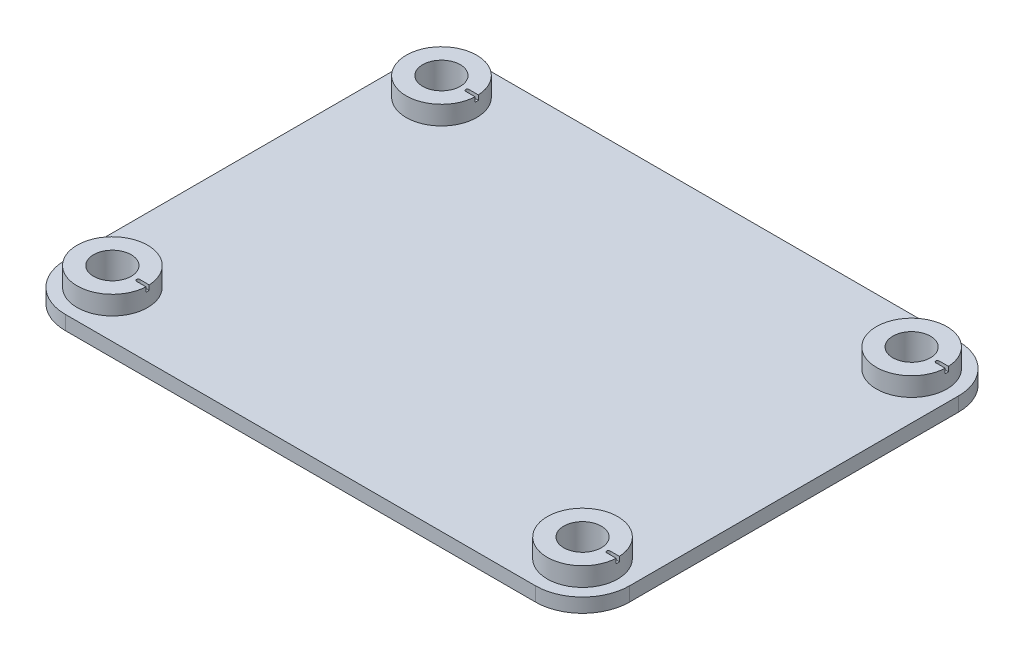
from build123d import *

# Parameters (mm, degrees)
SKETCH_1_R          = 30
EXTRUDE_1_DEPTH     = 10
SKETCH_2_R          = 40
EXTRUDE_2_DEPTH     = 60
CUT_EXTRUDE_START   = -40
SKETCH_3_R          = 75
CUT_EXTRUDE_1_DEPTH = 40
CUT_EXTRUDE_2_DEPTH = 10


with BuildPart() as part:
    # 草图1 → 凸台-拉伸1 (new body)
    with BuildSketch(Plane(origin=(0, 0, 0), x_dir=(1, 0, 0), z_dir=(0, 1, 0))):
        with BuildLine():
            Line((-500, -450), (500, -450))
            ThreePointArc((500, -450), (570.710678119, -420.710678119), (600, -350))
            Line((600, -350), (600, 350))
            ThreePointArc((600, 350), (570.710678119, 420.710678119), (500, 450))
            Line((500, 450), (-500, 450))
            ThreePointArc((-500, 450), (-570.710678119, 420.710678119), (-600, 350))
            Line((-600, 350), (-600, -350))
            ThreePointArc((-600, -350), (-570.710678119, -420.710678119), (-500, -450))
        make_face()
        with Locations((-500, 350)):
            Circle(SKETCH_1_R, mode=Mode.SUBTRACT)
        with Locations((500, 350)):
            Circle(SKETCH_1_R, mode=Mode.SUBTRACT)
        with Locations((-500, -350)):
            Circle(SKETCH_1_R, mode=Mode.SUBTRACT)
        with Locations((500, -350)):
            Circle(SKETCH_1_R, mode=Mode.SUBTRACT)
    extrude(amount=EXTRUDE_1_DEPTH)

    # 草图2 → 凸台-拉伸2 (add)
    with BuildSketch(Plane(origin=(0, 10, 0), x_dir=(1, 0, 0), z_dir=(0, 1, 0))):
        with BuildLine():
            Line((600, -350), (600, 350))
            ThreePointArc((600, 350), (570.710678119, 420.710678119), (500, 450))
            Line((500, 450), (-500, 450))
            ThreePointArc((-500, 450), (-570.710678119, 420.710678119), (-600, 350))
            Line((-600, 350), (-600, -350))
            ThreePointArc((-600, -350), (-570.710678119, -420.710678119), (-500, -450))
            Line((-500, -450), (500, -450))
            ThreePointArc((500, -450), (570.710678119, -420.710678119), (600, -350))
        make_face()
        with Locations((-500, 350)):
            Circle(SKETCH_2_R, mode=Mode.SUBTRACT)
        with Locations((-500, -350)):
            Circle(SKETCH_2_R, mode=Mode.SUBTRACT)
        with Locations((500, -350)):
            Circle(SKETCH_2_R, mode=Mode.SUBTRACT)
        with Locations((500, 350)):
            Circle(SKETCH_2_R, mode=Mode.SUBTRACT)
    extrude(amount=EXTRUDE_2_DEPTH)

    # 草图3 → 切除-拉伸1 (cut)
    with BuildSketch(Plane(origin=(0, 70, 0), x_dir=(1, 0, 0), z_dir=(0, 1, 0)).offset(CUT_EXTRUDE_START)):
        with BuildLine():
            Line((600, -350), (600, 350))
            ThreePointArc((600, 350), (570.710678119, 420.710678119), (500, 450))
            Line((500, 450), (-500, 450))
            ThreePointArc((-500, 450), (-570.710678119, 420.710678119), (-600, 350))
            Line((-600, 350), (-600, -350))
            ThreePointArc((-600, -350), (-570.710678119, -420.710678119), (-500, -450))
            Line((-500, -450), (500, -450))
            ThreePointArc((500, -450), (570.710678119, -420.710678119), (600, -350))
        make_face()
        with Locations((-500, 350)):
            Circle(SKETCH_3_R, mode=Mode.SUBTRACT)
        with Locations((-500, -350)):
            Circle(SKETCH_3_R, mode=Mode.SUBTRACT)
        with Locations((500, 350)):
            Circle(SKETCH_3_R, mode=Mode.SUBTRACT)
        with Locations((500, -350)):
            Circle(SKETCH_3_R, mode=Mode.SUBTRACT)
    extrude(amount=CUT_EXTRUDE_1_DEPTH, mode=Mode.SUBTRACT)

    # 草图7 → 切除-拉伸2 (cut)
    with BuildSketch(Plane(origin=(0, 70, 0), x_dir=(1, 0, 0), z_dir=(0, 1, 0))):
        with BuildLine():
            Line((-425, 346.5), (-445, 346.5))
            ThreePointArc((-445, 346.5), (-448.5, 350), (-445, 353.5))
            Line((-445, 353.5), (-425, 353.5))
            ThreePointArc((-425, 353.5), (-421.5, 350), (-425, 346.5))
        make_face()
        with BuildLine():
            Line((575, 346.5), (555, 346.5))
            ThreePointArc((555, 346.5), (551.5, 350), (555, 353.5))
            Line((555, 353.5), (575, 353.5))
            ThreePointArc((575, 353.5), (578.5, 350), (575, 346.5))
        make_face()
        with BuildLine():
            Line((575, -353.5), (555, -353.5))
            ThreePointArc((555, -353.5), (551.5, -350), (555, -346.5))
            Line((555, -346.5), (575, -346.5))
            ThreePointArc((575, -346.5), (578.5, -350), (575, -353.5))
        make_face()
        with BuildLine():
            Line((-425, -353.5), (-445, -353.5))
            ThreePointArc((-445, -353.5), (-448.5, -350), (-445, -346.5))
            Line((-445, -346.5), (-425, -346.5))
            ThreePointArc((-425, -346.5), (-421.5, -350), (-425, -353.5))
        make_face()
    extrude(amount=-CUT_EXTRUDE_2_DEPTH, mode=Mode.SUBTRACT)


solid = part.part
